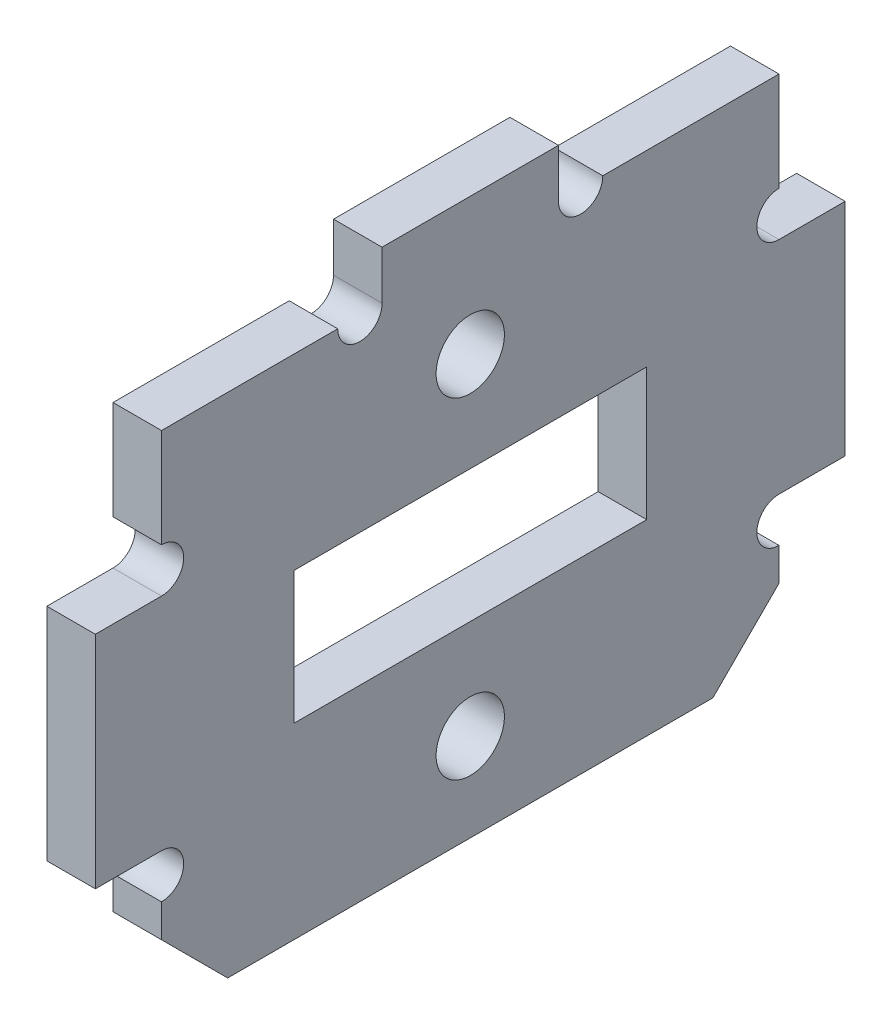
from build123d import *

# Parameters (mm, degrees)
SKETCH_1_R      = 1.55
SKETCH_1_W      = 16
SKETCH_1_H      = 6
EXTRUDE_1_DEPTH = 2.2
CHAMFER_1_SIZE  = 3


with BuildPart() as part:
    # 草图1 → 凸台-拉伸1 (new body)
    with BuildSketch(Plane(origin=(0, 0, 0), x_dir=(0, 0, -1), z_dir=(1, 0, 0))):
        with BuildLine():
            Line((-14, -11.5), (14, -11.5))
            Line((14, -11.5), (14, -7.01))
            ThreePointArc((14, -7.01), (12.995, -6.005), (14, -5))
            Line((14, -5), (17, -5))
            Line((17, -5), (17, 5))
            Line((17, 5), (14, 5))
            ThreePointArc((14, 5), (12.995, 6.005), (14, 7.01))
            Line((14, 7.01), (14, 11.5))
            Line((14, 11.5), (6.01, 11.5))
            ThreePointArc((6.01, 11.5), (5.005, 10.495), (4, 11.5))
            Line((4, 11.5), (4, 13.7))
            Line((4, 13.7), (-4, 13.7))
            Line((-4, 13.7), (-4, 11.5))
            ThreePointArc((-4, 11.5), (-5.005, 10.495), (-6.01, 11.5))
            Line((-6.01, 11.5), (-14, 11.5))
            Line((-14, 11.5), (-14, 7.01))
            ThreePointArc((-14, 7.01), (-13.289357685, 6.715642315), (-12.995, 6.005))
            ThreePointArc((-12.995, 6.005), (-13.289357685, 5.294357685), (-14, 5))
            Line((-14, 5), (-17, 5))
            Line((-17, 5), (-17, -5))
            Line((-17, -5), (-14, -5))
            ThreePointArc((-14, -5), (-13.289357685, -5.294357685), (-12.995, -6.005))
            ThreePointArc((-12.995, -6.005), (-13.289357685, -6.715642315), (-14, -7.01))
            Line((-14, -7.01), (-14, -11.5))
        make_face()
        with Locations((0, -7.5)):
            Circle(SKETCH_1_R, mode=Mode.SUBTRACT)
        Rectangle(SKETCH_1_W, SKETCH_1_H, mode=Mode.SUBTRACT)
        with Locations((0, 7.5)):
            Circle(SKETCH_1_R, mode=Mode.SUBTRACT)
    extrude(amount=EXTRUDE_1_DEPTH)

    # 倒角1
    chamfer_1_edges = [part.edges().sort_by_distance(p)[0] for p in [
        (1.1, -11.5, -14),
        (1.1, -11.5, 14),
    ]]
    chamfer(chamfer_1_edges, length=CHAMFER_1_SIZE)


solid = part.part
